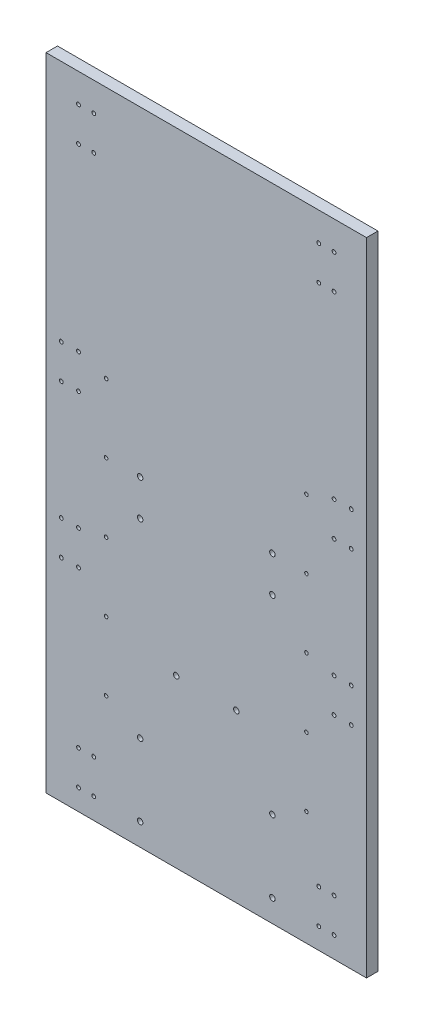
from build123d import *

# Parameters (mm, degrees)
SKETCH1_W                        = 533.146
SKETCH1_H                        = 1066.799994849
BOSS_EXTRUDE1_DEPTH              = 19.05
F_23_64_0_35938_DIAMETER_HOLE1_D = 9.128252
F_15_64_0_23438_DIAMETER_HOLE1_D = 5.953252
F_1_4_0_25_DIAMETER_HOLE1_D      = 6.35


with BuildPart() as part:
    # Sketch1 → Boss-Extrude1 (new body)
    with BuildSketch(Plane.XY):
        with Locations((0, 6469.379997497)):
            Rectangle(SKETCH1_W, SKETCH1_H)
    extrude(amount=-BOSS_EXTRUDE1_DEPTH)

    # 23/64 (0.35938) Diameter Hole1 (through all)
    with Locations(Plane(origin=(0, 0, -19.05), x_dir=(-1, 0, 0), z_dir=(0, 0, -1))):
        with Locations((110, 5973.262000072), (110, 6093.262000072), (-110, 6093.262000072), (-110, 5973.262000072), (-50, 6213.262000072), (50, 6213.262000072), (-110, 6409.662000072), (-110, 6469.662000072), (110, 6409.662000072), (110, 6469.662000072)):
            Hole(F_23_64_0_35938_DIAMETER_HOLE1_D / 2)

    # 15/64 (0.23438) Diameter Hole1 (through all)
    with Locations(Plane(origin=(0, 0, -19.05), x_dir=(-1, 0, 0), z_dir=(0, 0, -1))):
        with Locations((166.6875, 6125.895804781), (166.6875, 6240.195804781), (166.6875, 6354.495804781), (166.6875, 6468.795804781), (166.6875, 6583.095804781), (-166.6875, 6125.895804781), (-166.6875, 6240.195804781), (-166.6875, 6354.495804781), (-166.6875, 6468.795804781), (-166.6875, 6583.095804781)):
            Hole(F_15_64_0_23438_DIAMETER_HOLE1_D / 2)

    # 1/4 (0.25) Diameter Hole1 (through all)
    with Locations(Plane.XY):
        with Locations((-212.598, 6955.154994921), (-212.598, 6898.004994921), (-187.198, 6898.004994921), (-187.198, 6955.154994921), (-241.173, 6598.970804781), (-241.173, 6541.820804781), (-212.598, 6541.820804781), (-212.598, 6598.970804781), (-212.598, 6344.970804781), (-241.173, 6344.970804781), (-241.173, 6287.820804781), (-212.598, 6287.820804781), (-212.598, 6028.055000072), (-187.198, 6028.055000072), (-187.198, 5970.905000072), (-212.598, 5970.905000072), (212.598, 5970.905000072), (187.198, 5970.905000072), (187.198, 6028.055000072), (212.598, 6028.055000072), (212.598, 6287.820804781), (241.173, 6287.820804781), (241.173, 6344.970804781), (212.598, 6344.970804781), (212.598, 6598.970804781), (212.598, 6541.820804781), (241.173, 6541.820804781), (241.173, 6598.970804781), (187.198, 6955.154994921), (187.198, 6898.004994921), (212.598, 6898.004994921), (212.598, 6955.154994921)):
            Hole(F_1_4_0_25_DIAMETER_HOLE1_D / 2)


solid = part.part
